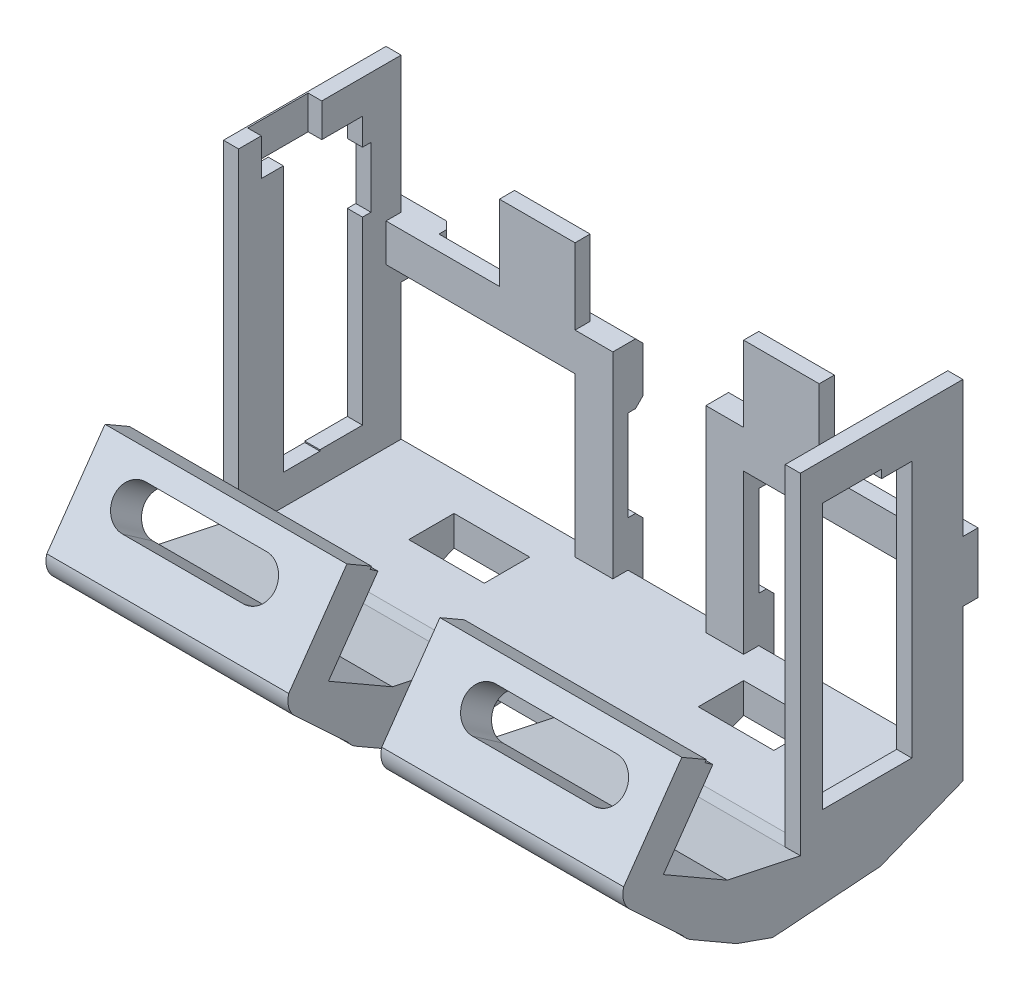
from build123d import *

# Parameters (mm, degrees)
EXTRUDE_2_DEPTH      = 10
SKETCH_6_W           = 2
SKETCH_6_H           = 18
EXTRUDE_3_DEPTH      = 2
EXTRUDE_4_DEPTH      = 9.5
SKETCH_8_W           = 7
SKETCH_8_H           = 28
CUT_EXTRUDE_3_DEPTH  = 25.5
SKETCH_9_W           = 7.5
SKETCH_9_H           = 8
CUT_EXTRUDE_4_DEPTH  = 25.5
SKETCH_10_W          = 1.5
SKETCH_10_H          = 3
CUT_EXTRUDE_5_DEPTH  = 32
EXTRUDE_5_DEPTH      = 32
FILLET_1_R           = 3
FILLET_2_R           = 3
SKETCH_15_W          = 10
SKETCH_15_H          = 2
EXTRUDE_6_DEPTH      = 10
CUT_EXTRUDE_7_DEPTH  = 10
SKETCH_17_W          = 5
SKETCH_17_H          = 6
CUT_EXTRUDE_8_DEPTH  = 10
SKETCH_18_W          = 1.50410549
SKETCH_18_H          = 3
CUT_EXTRUDE_9_DEPTH  = 32
SKETCH_19_W          = 5
SKETCH_19_H          = 6
CUT_EXTRUDE_10_DEPTH = 10
CUT_EXTRUDE_11_DEPTH = 10
SKETCH_22_W          = 1.8
SKETCH_22_H          = 8
CUT_EXTRUDE_12_DEPTH = 34
CUT_EXTRUDE_13_DEPTH = 34
EXTRUDE_7_DEPTH      = 2
CHAMFER_1_SIZE       = 1
EXTRUDE_START        = 10
SKETCH_25_W          = 32
SKETCH_25_H          = 15
EXTRUDE_8_DEPTH      = 10
EXTRUDE_9_DEPTH      = 32
CUT_EXTRUDE_15_DEPTH = 10
FILLET_3_R           = 3
SKETCH_28_W          = 12.226221142
SKETCH_28_H          = 35.391692779
CUT_EXTRUDE_16_DEPTH = 10
CUT_EXTRUDE_17_DEPTH = 95
CUT_EXTRUDE_18_DEPTH = 95
SKETCH_31_W          = 3
SKETCH_31_H          = 34
EXTRUDE_10_DEPTH     = 2
SKETCH_32_W          = 3
SKETCH_32_H          = 35.103131655
EXTRUDE_11_DEPTH     = 2
SKETCH_33_W          = 32
SKETCH_33_H          = 13.416826231
EXTRUDE_12_DEPTH     = 5
CUT_EXTRUDE_19_DEPTH = 5


with BuildPart() as part:
    # 草图5 → 凸台-拉伸2 (new body)
    with BuildSketch(Plane.XY):
        Polygon((-38.15, -23), (-38.15, 23), (-36.15, 23), (-36.15, -21), (36.15, -21), (36.15, 23), (38.15, 23), (38.15, -23), align=None)
    extrude(amount=EXTRUDE_2_DEPTH)

    # 草图6 → 凸台-拉伸3 (add)
    with BuildSketch(Plane(origin=(0, 0, 0), x_dir=(-1, 0, 0), z_dir=(0, 0, -1))):
        Polygon((-6.15, 5), (-36.15, 5), (-36.15, 0), (-11.15, 0), (-11.15, -21), (-6.15, -21), align=None)
        Polygon((-36.15, 0), (-36.15, 5), (-36.15, 23), (-38.15, 23), (-38.15, 5), (-38.15, 0), (-38.15, -23), (-11.15, -23), (-6.15, -23), (6.15, -23), (11.15, -23), (38.15, -23), (38.15, 0), (38.15, 5), (36.15, 5), (36.15, 0), (36.15, -21), (11.15, -21), (6.15, -21), (-6.15, -21), (-11.15, -21), (-36.15, -21), align=None)
        Polygon((6.15, 0), (6.15, -21), (11.15, -21), (11.15, 0), (36.15, 0), (36.15, 5), (6.15, 5), align=None)
        with Locations((37.15, 14)):
            Rectangle(SKETCH_6_W, SKETCH_6_H)
    extrude(amount=EXTRUDE_3_DEPTH)

    # 草图7 → 凸台-拉伸4 (add)
    with BuildSketch(Plane.XY.offset(10)):
        Polygon((36.15, 23), (36.15, -21), (-36.15, -21), (-36.15, 23), (-38.15, 23), (-38.15, -23), (38.15, -23), (38.15, 23), align=None)
    extrude(amount=EXTRUDE_4_DEPTH)

    # 草图8 → 切除-拉伸3 (cut)
    with BuildSketch(Plane(origin=(38.15, 0, 0), x_dir=(0, 0, -1), z_dir=(1, 0, 0))):
        with Locations((-5.25, 0)):
            Rectangle(SKETCH_8_W, SKETCH_8_H)
    extrude(amount=-CUT_EXTRUDE_3_DEPTH, mode=Mode.SUBTRACT)

    # 草图9 → 切除-拉伸4 (cut)
    with BuildSketch(Plane.ZY.offset(38.15)):
        with Locations((5.75, 11)):
            Rectangle(SKETCH_9_W, SKETCH_9_H)
    extrude(amount=-CUT_EXTRUDE_4_DEPTH, mode=Mode.SUBTRACT)

    # 草图10 → 切除-拉伸5 (cut)
    with BuildSketch(Plane(origin=(0, 23, 0), x_dir=(1, 0, 0), z_dir=(0, 1, 0))):
        with Locations((-36.9, -12)):
            Rectangle(SKETCH_10_W, SKETCH_10_H)
    extrude(amount=-CUT_EXTRUDE_5_DEPTH, mode=Mode.SUBTRACT)

    # 草图11 → 凸台-拉伸5 (add)
    with BuildSketch(Plane(origin=(38.15, 0, 0), x_dir=(0, 0, -1), z_dir=(1, 0, 0))):
        Polygon((-27.947222626, -26.659598219), (-23.155372135, -28.359869707), (-8.903497586, -27.324579693), (2, -23), (-19.5, -20.812742031), (-29.153549837, -18.784030413), (-23.27364124, -8.564706774), (-27.607476664, -6.071140951), (-36.607476664, -21.659598219), align=None)
    extrude_5 = extrude(amount=-EXTRUDE_5_DEPTH)

    # 镜向1: 凸台-拉伸5 across plane
    add(extrude_5.mirror(Plane(origin=(0, 0, 0), x_dir=(0, 0, 1), z_dir=(1, 0, 0))))

    # 圆角1
    fillet_1_edges = [part.edges().sort_by_distance(p)[0] for p in [
        (-22.15, -21.659598219, 36.607476664),
    ]]
    fillet(fillet_1_edges, radius=FILLET_1_R)

    # 圆角2
    fillet_2_edges = [part.edges().sort_by_distance(p)[0] for p in [
        (22.15, -21.659598219, 36.607476664),
    ]]
    fillet(fillet_2_edges, radius=FILLET_2_R)

    # 草图15 → 凸台-拉伸6 (add)
    with BuildSketch(Plane(origin=(0, 5, 0), x_dir=(1, 0, 0), z_dir=(0, 1, 0))):
        with Locations((-16.15, 1)):
            Rectangle(SKETCH_15_W, SKETCH_15_H)
        with Locations((16.15, 1)):
            Rectangle(SKETCH_15_W, SKETCH_15_H)
    extrude(amount=EXTRUDE_6_DEPTH)

    # 草图16 → 切除-拉伸7 (cut)
    with BuildSketch(Plane(origin=(38.15, 0, 0), x_dir=(0, 0, -1), z_dir=(1, 0, 0))):
        Polygon((-9.75, 5), (-8.75, 5), (-8.75, 14), (-1.75, 14), (-1.75, 17), (-9.75, 17), align=None)
    extrude(amount=-CUT_EXTRUDE_7_DEPTH, mode=Mode.SUBTRACT)

    # 草图17 → 切除-拉伸8 (cut)
    with BuildSketch(Plane(origin=(0, -21, 0), x_dir=(1, 0, 0), z_dir=(0, 1, 0))):
        with Locations((-21.65, -6)):
            Rectangle(SKETCH_17_W, SKETCH_17_H)
    cut_extrude_8 = extrude(amount=-CUT_EXTRUDE_8_DEPTH, mode=Mode.SUBTRACT)

    # 镜向3: 切除-拉伸8 across plane
    add(cut_extrude_8.mirror(Plane(origin=(0, 0, 0), x_dir=(0, 0, 1), z_dir=(1, 0, 0))), mode=Mode.SUBTRACT)

    # 草图18 → 切除-拉伸9 (cut)
    with BuildSketch(Plane(origin=(0, 23, 0), x_dir=(1, 0, 0), z_dir=(0, 1, 0))):
        with Locations((-36.902052745, -15)):
            Rectangle(SKETCH_18_W, SKETCH_18_H)
    extrude(amount=-CUT_EXTRUDE_9_DEPTH, mode=Mode.SUBTRACT)

    # 草图19 → 切除-拉伸10 (cut)
    with BuildSketch(Plane(origin=(0, -21, 0), x_dir=(1, 0, 0), z_dir=(0, 1, 0))):
        with Locations((-16.65, -6)):
            Rectangle(SKETCH_19_W, SKETCH_19_H)
    cut_extrude_10 = extrude(amount=-CUT_EXTRUDE_10_DEPTH, mode=Mode.SUBTRACT)

    # 镜向4: 切除-拉伸10 across plane
    add(cut_extrude_10.mirror(Plane(origin=(0, 0, 0), x_dir=(0, 0, 1), z_dir=(1, 0, 0))), mode=Mode.SUBTRACT)

    # 草图21 → 切除-拉伸11 (cut)
    with BuildSketch(Plane(origin=(0, 10.436602825, 18.076726351), x_dir=(1, 0, 0), z_dir=(0, 0.5000000000000001, 0.8660254037844386))):
        with BuildLine():
            Line((-29.15, -23.561500625), (-14.15, -23.561500625))
            ThreePointArc((-14.15, -23.561500625), (-11.4, -26.311500625), (-14.15, -29.061500625))
            Line((-14.15, -29.061500625), (-29.15, -29.061500625))
            ThreePointArc((-29.15, -29.061500625), (-31.9, -26.311500625), (-29.15, -23.561500625))
        make_face()
        with BuildLine():
            Line((14.15, -23.561500625), (29.15, -23.561500625))
            ThreePointArc((29.15, -23.561500625), (31.9, -26.311500625), (29.15, -29.061500625))
            Line((29.15, -29.061500625), (14.15, -29.061500625))
            ThreePointArc((14.15, -29.061500625), (11.4, -26.311500625), (14.15, -23.561500625))
        make_face()
    extrude(amount=-CUT_EXTRUDE_11_DEPTH, mode=Mode.SUBTRACT)

    # 草图22 → 切除-拉伸12 (cut)
    with BuildSketch(Plane(origin=(0, 23, 0), x_dir=(1, 0, 0), z_dir=(0, 1, 0))):
        with Locations((-37.05, -12.5)):
            Rectangle(SKETCH_22_W, SKETCH_22_H)
    extrude(amount=-CUT_EXTRUDE_12_DEPTH, mode=Mode.SUBTRACT)

    # 草图23 → 切除-拉伸13 (cut)
    with BuildSketch(Plane(origin=(38.15, 0, 0), x_dir=(0, 0, -1), z_dir=(1, 0, 0))):
        Polygon((-8.75, -14), (-8.75, 1), (-14.75, 1), (-14.75, -14), (-14.75, -17), (-1.75, -17), (-1.75, -14), align=None)
    extrude(amount=-CUT_EXTRUDE_13_DEPTH, mode=Mode.SUBTRACT)

    # 草图24 → 凸台-拉伸7 (add)
    with BuildSketch(Plane(origin=(0, 0, -2), x_dir=(-1, 0, 0), z_dir=(0, 0, -1))):
        Polygon((6.15, 5), (6.15, -3), (11.15, -3), (11.15, 0), (14.15, 0), (14.15, 5), (11.15, 5), align=None)
        Polygon((6.15, -21), (6.15, -23), (11.15, -23), (11.15, -21), (11.15, -14.999314237), (6.15, -14.999314237), align=None)
        Polygon((36.15, -3), (38.15, -3), (38.15, 5), (36.15, 5), (31.15, 5), (31.15, 0), (36.15, 0), align=None)
    extrude_7 = extrude(amount=EXTRUDE_7_DEPTH)

    # 镜向5: 凸台-拉伸7 across plane
    add(extrude_7.mirror(Plane(origin=(0, 0, 0), x_dir=(0, 0, 1), z_dir=(1, 0, 0))))

    # 倒角1
    chamfer_1_edges = [part.edges().sort_by_distance(p)[0] for p in [
        (-8.65, -14.999314237, -4),
        (8.65, -14.999314237, -4),
        (-31.15, 2.5, -4),
        (31.15, 2.5, -4),
        (-14.15, 2.5, -4),
        (-10.15, 5, -4),
        (-8.65, -3, -4),
        (8.65, -3, -4),
        (10.15, 5, -4),
        (14.15, 2.5, -4),
    ]]
    chamfer(chamfer_1_edges, length=CHAMFER_1_SIZE)

    # 草图25 → 凸台-拉伸8 (add)
    # profile 1 of 2: a face of its own
    with BuildSketch(Plane(origin=(0, 10.436602825, 18.076726351), x_dir=(1, 0, 0), z_dir=(0, 0.5000000000000001, 0.8660254037844386)).offset(EXTRUDE_START)):
        with Locations((22.15, -26.561500625)):
            Rectangle(SKETCH_25_W, SKETCH_25_H)
        with BuildLine():
            Line((14.15, -23.561500625), (29.15, -23.561500625))
            ThreePointArc((29.15, -23.561500625), (31.9, -26.311500625), (29.15, -29.061500625))
            Line((29.15, -29.061500625), (14.15, -29.061500625))
            ThreePointArc((14.15, -29.061500625), (11.4, -26.311500625), (14.15, -23.561500625))
        make_face(mode=Mode.SUBTRACT)
    # profile 2 of 2: a face of its own
    with BuildSketch(Plane(origin=(0, 10.436602825, 18.076726351), x_dir=(1, 0, 0), z_dir=(0, 0.5000000000000001, 0.8660254037844386)).offset(EXTRUDE_START)):
        with Locations((-22.15, -26.561500625)):
            Rectangle(SKETCH_25_W, SKETCH_25_H)
        with BuildLine():
            Line((-14.15, -29.061500625), (-29.15, -29.061500625))
            ThreePointArc((-29.15, -29.061500625), (-31.9, -26.311500625), (-29.15, -23.561500625))
            Line((-29.15, -23.561500625), (-14.15, -23.561500625))
            ThreePointArc((-14.15, -23.561500625), (-11.4, -26.311500625), (-14.15, -29.061500625))
        make_face(mode=Mode.SUBTRACT)
    extrude(amount=-EXTRUDE_8_DEPTH)

    # 草图26 → 凸台-拉伸9 (add)
    with BuildSketch(Plane(origin=(38.15, 0, 0), x_dir=(0, 0, -1), z_dir=(1, 0, 0))):
        with BuildLine():
            Line((-43.767730702, -14.061522007), (-34.996197894, -22.23956804))
            ThreePointArc((-34.996197894, -22.23956804), (-35.507563084, -20.66650219), (-35.107476664, -19.061522007))
            Line((-35.107476664, -19.061522007), (-43.767730702, -14.061522007))
        make_face()
    extrude_9 = extrude(amount=-EXTRUDE_9_DEPTH)

    # 镜向7: 凸台-拉伸9 across plane
    add(extrude_9.mirror(Plane(origin=(0, 0, 0), x_dir=(0, 0, 1), z_dir=(1, 0, 0))))

    # 草图27 → 切除-拉伸15 (cut)
    with BuildSketch(Plane(origin=(0, 7.930284472, 13.782891728), x_dir=(-1, 0, 0), z_dir=(0, -0.4987131647423246, -0.86676708481154))):
        Polygon((-6.15, -30.820638385), (6.15, -30.820638385), (38.15, -30.820638385), (42.174164157, -30.820638385), (42.174164157, -16.561104399), (-38.15, -16.561104399), (-38.15, -19.030477201), (-6.15, -19.030477201), align=None)
    cut_extrude_15 = extrude(amount=-CUT_EXTRUDE_15_DEPTH, mode=Mode.SUBTRACT)

    # 镜向8: 切除-拉伸15 across plane
    add(cut_extrude_15.mirror(Plane(origin=(0, 0, 0), x_dir=(0, 0, 1), z_dir=(1, 0, 0))), mode=Mode.SUBTRACT)

    # 圆角3
    fillet_3_edges = [part.edges().sort_by_distance(p)[0] for p in [
        (-22.15, -14.061522007, 43.767730702),
        (22.15, -14.061522007, 43.767730702),
    ]]
    fillet(fillet_3_edges, radius=FILLET_3_R)

    # 草图28 → 切除-拉伸16 (cut)
    with BuildSketch(Plane.ZY.offset(38.15)):
        with Locations((9.227199623, 0.86169181)):
            Rectangle(SKETCH_28_W, SKETCH_28_H)
    extrude(amount=-CUT_EXTRUDE_16_DEPTH, mode=Mode.SUBTRACT)

    # 草图29 → 切除-拉伸17 (cut)
    with BuildSketch(Plane(origin=(38.15, 0, 0), x_dir=(0, 0, -1), z_dir=(1, 0, 0))):
        with BuildLine():
            Line((-42.867599384, -12.694168141), (-35.172024007, -1.703747506))
            Line((-35.172024007, -1.703747506), (-36.267730702, -1.071140951))
            Line((-36.267730702, -1.071140951), (-42.574461771, -11.994719593))
            ThreePointArc((-42.574461771, -11.994719593), (-42.743221901, -12.335143524), (-42.867599384, -12.694168141))
        make_face()
    extrude(amount=-CUT_EXTRUDE_17_DEPTH, mode=Mode.SUBTRACT)

    # 草图30 → 切除-拉伸18 (cut)
    with BuildSketch(Plane(origin=(38.15, 0, 0), x_dir=(0, 0, -1), z_dir=(1, 0, 0))):
        Polygon((-14.75, -17), (-16.578106309, -17), (-16.578106309, 18.103131655), (-14.75, 18.103131655), (-8.75, 18.103131655), (-8.75, -17), align=None)
    extrude(amount=-CUT_EXTRUDE_18_DEPTH, mode=Mode.SUBTRACT)

    # 草图31 → 凸台-拉伸10 (add)
    with BuildSketch(Plane(origin=(38.15, 0, 0), x_dir=(0, 0, -1), z_dir=(1, 0, 0))):
        with Locations((-3.25, 0)):
            Rectangle(SKETCH_31_W, SKETCH_31_H)
    extrude(amount=-EXTRUDE_10_DEPTH)

    # 草图32 → 凸台-拉伸11 (add)
    with BuildSketch(Plane.ZY.offset(38.15)):
        with Locations((15.078106309, 0.551565828)):
            Rectangle(SKETCH_32_W, SKETCH_32_H)
    extrude(amount=-EXTRUDE_11_DEPTH)

    # 草图33 → 凸台-拉伸12 (add)
    with BuildSketch(Plane(origin=(0, 15.964929939, 22.80028287), x_dir=(1, 0, 0), z_dir=(0, 0.5735764363510407, 0.8191520442889957))):
        with Locations((22.15, -28.277885557)):
            Rectangle(SKETCH_33_W, SKETCH_33_H)
        with Locations((-22.15, -28.277885557)):
            Rectangle(SKETCH_33_W, SKETCH_33_H)
    extrude(amount=-EXTRUDE_12_DEPTH)

    # 草图34 → 切除-拉伸19 (cut)
    with BuildSketch(Plane(origin=(0, 15.964929939, 22.80028287), x_dir=(1, 0, 0), z_dir=(0, 0.5735764363510407, 0.8191520442889957))):
        with BuildLine():
            Line((-31.15, -24.369472442), (-15.15, -24.369472442))
            ThreePointArc((-15.15, -24.369472442), (-12.45, -27.069472442), (-15.15, -29.769472442))
            Line((-15.15, -29.769472442), (-31.15, -29.769472442))
            ThreePointArc((-31.15, -29.769472442), (-33.85, -27.069472442), (-31.15, -24.369472442))
        make_face()
    cut_extrude_19 = extrude(amount=-CUT_EXTRUDE_19_DEPTH, mode=Mode.SUBTRACT)

    # 镜向9: 切除-拉伸19 across plane
    add(cut_extrude_19.mirror(Plane(origin=(0, 0, 0), x_dir=(0, 0, 1), z_dir=(1, 0, 0))), mode=Mode.SUBTRACT)


solid = part.part
